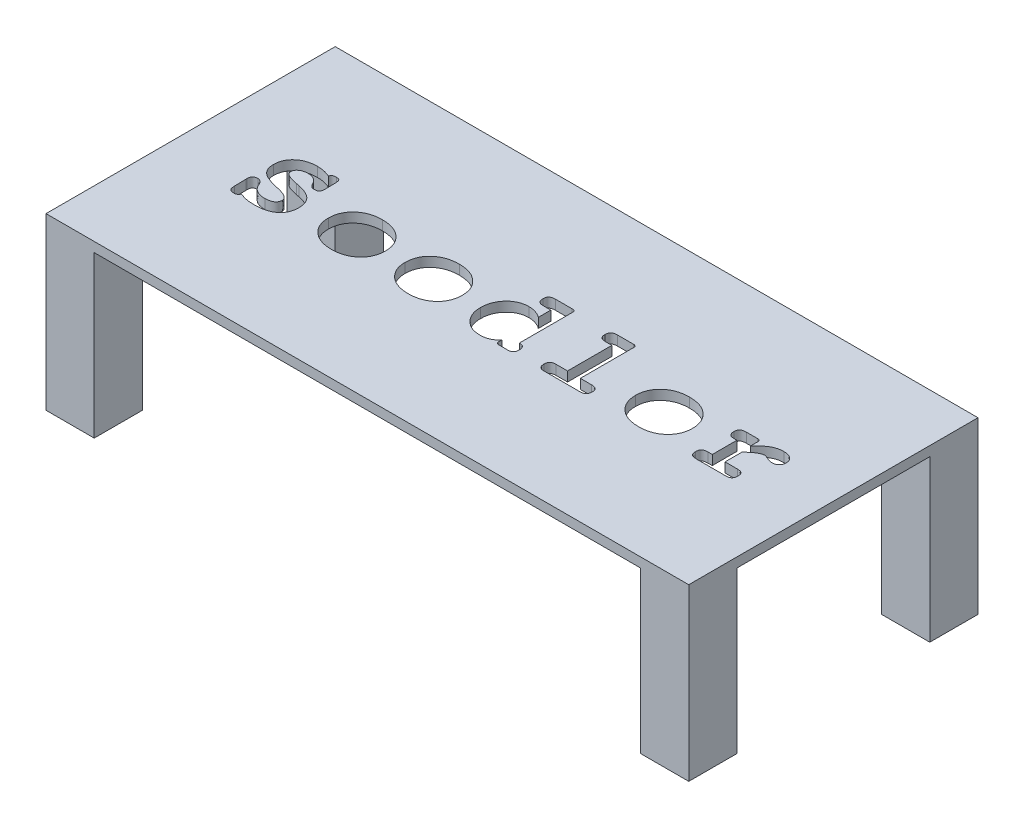
from build123d import *

# Parameters (mm, degrees)
SKETCH1_W           = 200
SKETCH1_H           = 90
BOSS_EXTRUDE1_DEPTH = 3
SKETCH2_W           = 15
SKETCH2_H           = 15
BOSS_EXTRUDE2_DEPTH = 50
CUT_EXTRUDE1_DEPTH  = 10


with BuildPart() as part:
    # Sketch1 → Boss-Extrude1 (new body)
    with BuildSketch(Plane(origin=(0, 0, 0), x_dir=(1, 0, 0), z_dir=(0, 1, 0))):
        Rectangle(SKETCH1_W, SKETCH1_H)
    extrude(amount=BOSS_EXTRUDE1_DEPTH)

    # Sketch2 → Boss-Extrude2 (add)
    with BuildSketch(Plane(origin=(0, 0, 0), x_dir=(-1, 0, 0), z_dir=(0, -1, 0))):
        with Locations((92.5, -37.5)):
            Rectangle(SKETCH2_W, SKETCH2_H)
        with Locations((92.5, 37.5)):
            Rectangle(SKETCH2_W, SKETCH2_H)
        with Locations((-92.5, -37.5)):
            Rectangle(SKETCH2_W, SKETCH2_H)
        with Locations((-92.5, 37.5)):
            Rectangle(SKETCH2_W, SKETCH2_H)
    extrude(amount=BOSS_EXTRUDE2_DEPTH)

    # Sketch3 → Cut-Extrude1 (cut)
    # profile 1 of 7: a face of its own
    with BuildSketch(Plane(origin=(0, 3, 0), x_dir=(1, 0, 0), z_dir=(0, 1, 0))):
        with BuildLine():
            add(Edge.make_bspline(
                [(-74.830880301, -9.316911034), (-74.872717316, -9.392583253), (-74.953316433, -9.538365981), (-75.089263433, -9.737289198), (-75.244768447, -9.894707863), (-75.406515023, -10.025670268), (-75.589241972, -10.124247081), (-75.800015205, -10.191115492), (-76.038968744, -10.226988972), (-76.207601854, -10.232824948), (-76.295464216, -10.235865647)],
                knots=[0, 0, 0, 0, 1.125130904, 2.167567619, 3.121740143, 3.993806461, 4.866860396, 5.805553904, 6.856634862, 8, 8, 8, 8], degree=3))
            add(Edge.make_bspline(
                [(-76.295464216, -10.235865647), (-76.448842947, -10.230072201), (-76.733878684, -10.219305786), (-77.127142465, -10.149877558), (-77.443028389, -10.014931546), (-77.694922661, -9.824478354), (-77.864971505, -9.549381594), (-77.987016234, -9.205694293), (-78.065302252, -8.779259205), (-78.08150604, -8.466911018), (-78.090297445, -8.29744576)],
                knots=[0, 0, 0, 0, 1.19497517, 2.220716172, 3.088578786, 3.84915171, 4.638209871, 5.565898967, 6.679372639, 8, 8, 8, 8], degree=3))
            Line((-78.090297445, -8.29744576), (-78.162090774, -4.549833978))
            Line((-78.162090774, -4.549833978), (-78.162090774, -4.372743766))
            add(Edge.make_bspline(
                [(-78.162090774, -4.372743766), (-78.158153423, -4.219337477), (-78.150882286, -3.936040917), (-78.08311521, -3.544551892), (-77.958779405, -3.227146808), (-77.787160273, -2.969120709), (-77.540532395, -2.784291518), (-77.226830072, -2.66275004), (-76.846197258, -2.587735738), (-76.568674894, -2.581339377), (-76.419905986, -2.577910538)],
                knots=[0, 0, 0, 0, 1.258531922, 2.324140461, 3.240671341, 4.039710179, 4.833152232, 5.725424941, 6.780689091, 8, 8, 8, 8], degree=3))
            add(Edge.make_bspline(
                [(-76.419905986, -2.577910538), (-76.336582814, -2.583140904), (-76.172400228, -2.59344698), (-75.931116962, -2.657247835), (-75.702417763, -2.770166028), (-75.488425899, -2.931972259), (-75.278594022, -3.130541354), (-75.084114689, -3.376355382), (-74.901832917, -3.666282067), (-74.795525882, -3.878753168), (-74.739942084, -3.989846011)],
                knots=[0, 0, 0, 0, 0.862109619, 1.698727773, 2.562257802, 3.48317382, 4.463674898, 5.543576174, 6.715631902, 8, 8, 8, 8], degree=3))
            add(Edge.make_bspline(
                [(-74.739942084, -3.989846011), (-74.688506393, -4.09496033), (-74.599112357, -4.27764657), (-74.513185847, -4.46198715), (-74.476699878, -4.540261534)],
                knots=[0, 0, 0, 0, 1.150763389, 2, 2, 2, 2], degree=3))
            add(Edge.make_bspline(
                [(-74.476699878, -4.540261534), (-74.363667126, -4.728707008), (-74.142817767, -5.096901727), (-73.731386053, -5.583813169), (-73.25464591, -5.982408046), (-72.726053704, -6.31635398), (-72.128083343, -6.56427928), (-71.464649877, -6.738517627), (-70.736124723, -6.851586805), (-70.2269803, -6.861322992), (-69.963292585, -6.866365399)],
                knots=[0, 0, 0, 0, 0.982757152, 1.920162832, 2.837434109, 3.755039021, 4.708845284, 5.722420853, 6.820433627, 8, 8, 8, 8], degree=3))
            add(Edge.make_bspline(
                [(-69.963292585, -6.866365399), (-69.729918819, -6.859319496), (-69.285835406, -6.845911953), (-68.661357262, -6.738555076), (-68.117171431, -6.556439983), (-67.656375081, -6.303985395), (-67.281844703, -5.981663936), (-67.015642358, -5.586793115), (-66.856374459, -5.130963817), (-66.837888477, -4.807992945), (-66.828317212, -4.640772195)],
                knots=[0, 0, 0, 0, 1.293732113, 2.461823289, 3.499898011, 4.462410317, 5.358847753, 6.212842595, 7.074684975, 8, 8, 8, 8], degree=3))
            add(Edge.make_bspline(
                [(-66.828317212, -4.640772195), (-66.83901695, -4.506249599), (-66.860731278, -4.233245908), (-67.057254058, -3.848167393), (-67.358032934, -3.492001514), (-67.785012056, -3.173268235), (-68.319042553, -2.873583781), (-68.970940596, -2.60442437), (-69.73757409, -2.362522057), (-70.291006898, -2.228199291), (-70.585501438, -2.156723007)],
                knots=[0, 0, 0, 0, 0.667298539, 1.354233194, 2.111195328, 2.978655329, 3.994226602, 5.160247515, 6.488901294, 8, 8, 8, 8], degree=3))
            add(Edge.make_bspline(
                [(-70.585501438, -2.156723007), (-70.759475117, -2.117153536), (-71.090049372, -2.041966022), (-71.555333592, -1.931056248), (-71.966668255, -1.837488407), (-72.219346808, -1.77123752), (-72.337258669, -1.740321698)],
                knots=[0, 0, 0, 0, 1.189004854, 2.259275063, 3.187694746, 4, 4, 4, 4], degree=3))
            add(Edge.make_bspline(
                [(-72.337258669, -1.740321698), (-72.58832812, -1.672170432), (-73.07411078, -1.540307702), (-73.767646309, -1.316175609), (-74.399691535, -1.07694486), (-74.972829706, -0.82869321), (-75.486091303, -0.567555881), (-75.937100982, -0.290029998), (-76.329608379, -0.002215695), (-76.665084706, 0.301154912), (-76.949066726, 0.630488933), (-77.191869995, 0.984121449), (-77.401453655, 1.36638809), (-77.566527017, 1.77845365), (-77.698205564, 2.218782896), (-77.785434531, 2.689038796), (-77.845930256, 3.187927137), (-77.852437434, 3.530711183), (-77.855772569, 3.706398874)],
                knots=[0, 0, 0, 0, 1.463732063, 2.832107426, 4.099267616, 5.265100837, 6.345135112, 7.336704633, 8.241627327, 9.080411787, 9.875950012, 10.682754482, 11.490207969, 12.323739583, 13.175869179, 14.072021647, 15.011849975, 16, 16, 16, 16], degree=3))
            add(Edge.make_bspline(
                [(-77.855772569, 3.706398874), (-77.849087943, 3.93166939), (-77.835941247, 4.374710305), (-77.739686197, 5.023631723), (-77.575897139, 5.639483163), (-77.350135746, 6.224988138), (-77.055962048, 6.77643061), (-76.700107899, 7.298416408), (-76.273474012, 7.782292829), (-75.792528246, 8.236026578), (-75.257609399, 8.645061532), (-74.681880348, 9.00634417), (-74.06581962, 9.308961847), (-73.410881339, 9.552618158), (-72.720418579, 9.743115554), (-71.992578991, 9.883346914), (-71.225494679, 9.964084359), (-70.700559144, 9.975369617), (-70.432342336, 9.981135841)],
                knots=[0, 0, 0, 0, 0.992234128, 1.951432983, 2.882273558, 3.794621431, 4.709564585, 5.62973003, 6.571255867, 7.545807784, 8.53829081, 9.53288696, 10.535595531, 11.556466521, 12.606887076, 13.687580771, 14.818465003, 16, 16, 16, 16], degree=3))
            add(Edge.make_bspline(
                [(-70.432342336, 9.981135841), (-70.072603891, 9.970590526), (-69.360099679, 9.949704292), (-68.300286343, 9.765755834), (-67.247169289, 9.480466339), (-66.56413923, 9.203486704), (-66.215680804, 9.062181228)],
                knots=[0, 0, 0, 0, 0.992740904, 1.96623988, 2.962445586, 4, 4, 4, 4], degree=3))
            add(Edge.make_bspline(
                [(-66.215680804, 9.062181228), (-66.176237569, 9.144669701), (-66.10201398, 9.299895068), (-65.967050184, 9.501633997), (-65.826882446, 9.66602347), (-65.666561876, 9.794304886), (-65.464570359, 9.883354775), (-65.215246999, 9.942081221), (-64.908147957, 9.971977201), (-64.685742122, 9.977903456), (-64.564434233, 9.981135841)],
                knots=[0, 0, 0, 0, 1.069344104, 2.012273056, 2.832922941, 3.591482327, 4.393857429, 5.395117902, 6.57920657, 8, 8, 8, 8], degree=3))
            add(Edge.make_bspline(
                [(-64.564434233, 9.981135841), (-64.442857652, 9.97690874), (-64.219822398, 9.969154017), (-63.915674238, 9.906018215), (-63.675057598, 9.792144475), (-63.494600471, 9.617918542), (-63.372787405, 9.372905895), (-63.295218514, 9.04989488), (-63.231900637, 8.643243138), (-63.220783327, 8.341376437), (-63.214719645, 8.176730169)],
                knots=[0, 0, 0, 0, 1.104668514, 2.026541791, 2.804895119, 3.492103925, 4.264216216, 5.256425918, 6.503580441, 8, 8, 8, 8], degree=3))
            Line((-63.214719645, 8.176730169), (-63.15249876, 5.05132724))
            Line((-63.15249876, 5.05132724), (-63.15249876, 4.874237028))
            add(Edge.make_bspline(
                [(-63.15249876, 4.874237028), (-63.155918646, 4.733350122), (-63.16223009, 4.473341482), (-63.236110909, 4.117051308), (-63.343576681, 3.820021519), (-63.520892583, 3.591589836), (-63.754595425, 3.426804049), (-64.047858123, 3.319327547), (-64.402022837, 3.254049593), (-64.659827934, 3.24631144), (-64.798959108, 3.242135345)],
                knots=[0, 0, 0, 0, 1.246463136, 2.300364134, 3.214218778, 4.020410916, 4.821002268, 5.716509432, 6.767655377, 8, 8, 8, 8], degree=3))
            add(Edge.make_bspline(
                [(-64.798959108, 3.242135345), (-64.891822071, 3.245735873), (-65.071145584, 3.25268869), (-65.32992305, 3.308771321), (-65.573905357, 3.391582441), (-65.792293291, 3.525871842), (-65.999291791, 3.683839344), (-66.1791224, 3.885395533), (-66.351369551, 4.114075812), (-66.438620329, 4.290226259), (-66.483709232, 4.381256168)],
                knots=[0, 0, 0, 0, 1.031275021, 1.991449058, 2.934094766, 3.880238862, 4.827712279, 5.819322876, 6.873083528, 8, 8, 8, 8], degree=3))
            add(Edge.make_bspline(
                [(-66.483709232, 4.381256168), (-66.511834906, 4.442174679), (-66.561799965, 4.550395979), (-66.617366712, 4.655842907), (-66.641654557, 4.701933038)],
                knots=[0, 0, 0, 0, 1.125813694, 2, 2, 2, 2], degree=3))
            add(Edge.make_bspline(
                [(-66.641654557, 4.701933038), (-66.728802961, 4.849636033), (-66.900123856, 5.139998315), (-67.219377775, 5.527292185), (-67.58779206, 5.855009474), (-67.996552691, 6.129214486), (-68.445344173, 6.347650701), (-68.934635456, 6.498168913), (-69.458213343, 6.598893007), (-69.820809044, 6.607322019), (-70.006368583, 6.611635593)],
                knots=[0, 0, 0, 0, 1.008657172, 1.982871076, 2.940827153, 3.902185302, 4.872678568, 5.867905458, 6.908893625, 8, 8, 8, 8], degree=3))
            add(Edge.make_bspline(
                [(-70.006368583, 6.611635593), (-70.238387072, 6.605922329), (-70.683786444, 6.594954736), (-71.315377573, 6.466701059), (-71.881007911, 6.269104915), (-72.364862277, 5.98597075), (-72.764357923, 5.645234594), (-73.051539043, 5.240996571), (-73.228923602, 4.787553428), (-73.250191439, 4.467383315), (-73.260999504, 4.304676617)],
                knots=[0, 0, 0, 0, 1.250794327, 2.401114711, 3.463703516, 4.471174861, 5.411065496, 6.276153812, 7.123961572, 8, 8, 8, 8], degree=3))
            add(Edge.make_bspline(
                [(-73.260999504, 4.304676617), (-73.247001936, 4.184046458), (-73.218180992, 3.935669365), (-73.001497005, 3.589134574), (-72.661789336, 3.277187964), (-72.193304482, 2.991053938), (-71.603954972, 2.719143482), (-70.883892692, 2.475257886), (-70.036270892, 2.247047111), (-69.423265396, 2.121810748), (-69.096986413, 2.055152303)],
                knots=[0, 0, 0, 0, 0.575216185, 1.184368198, 1.902840588, 2.771560498, 3.800045154, 5.005375968, 6.4060781, 8, 8, 8, 8], degree=3))
            add(Edge.make_bspline(
                [(-69.096986413, 2.055152303), (-68.988378551, 2.035028687), (-68.785318602, 1.997404334), (-68.504314652, 1.936007551), (-68.265246609, 1.896815864), (-68.122118412, 1.867283309), (-68.058376252, 1.854130982)],
                knots=[0, 0, 0, 0, 1.252859378, 2.34242306, 3.261797903, 4, 4, 4, 4], degree=3))
            add(Edge.make_bspline(
                [(-68.058376252, 1.854130982), (-67.815425747, 1.798578429), (-67.34302303, 1.690559813), (-66.66208967, 1.502057254), (-66.033196699, 1.280301824), (-65.453691991, 1.037743632), (-64.923100164, 0.771564229), (-64.449312354, 0.471730455), (-64.017820469, 0.156697654), (-63.637103624, -0.189551998), (-63.305055736, -0.566248539), (-63.014849088, -0.96874633), (-62.775536046, -1.406025479), (-62.571412481, -1.870574234), (-62.420570614, -2.372534954), (-62.309591646, -2.904002434), (-62.249231862, -3.466768247), (-62.238850714, -3.850915056), (-62.233544147, -4.047280674)],
                knots=[0, 0, 0, 0, 1.307952211, 2.543234804, 3.705798313, 4.805287046, 5.838839316, 6.816940384, 7.744716293, 8.639720481, 9.511710956, 10.376069779, 11.238154396, 12.123233041, 13.034347239, 13.983527126, 14.969232766, 16, 16, 16, 16], degree=3))
            add(Edge.make_bspline(
                [(-62.233544147, -4.047280674), (-62.240537732, -4.288444092), (-62.254159559, -4.758172605), (-62.343741397, -5.442237781), (-62.50236158, -6.082381744), (-62.722655472, -6.680317346), (-63.006660264, -7.235062842), (-63.355105605, -7.748148436), (-63.767219917, -8.217043598), (-64.241515615, -8.639900716), (-64.768718142, -9.020944591), (-65.357517764, -9.344159397), (-65.99723063, -9.624821436), (-66.694499345, -9.845984809), (-67.442867378, -10.024579787), (-68.245115978, -10.144915417), (-69.100150645, -10.224755138), (-69.688686725, -10.232086939), (-69.992009917, -10.235865647)],
                knots=[0, 0, 0, 0, 1.027461098, 2.001247864, 2.932670853, 3.831634272, 4.710168172, 5.581149534, 6.467380143, 7.362635631, 8.283156822, 9.232511859, 10.218744292, 11.254802792, 12.34456336, 13.493350062, 14.708107987, 16, 16, 16, 16], degree=3))
            add(Edge.make_bspline(
                [(-69.992009917, -10.235865647), (-70.22822348, -10.233487525), (-70.686705156, -10.228871681), (-71.355460586, -10.182333225), (-71.987464663, -10.120544816), (-72.778401237, -9.983106105), (-73.736115622, -9.747871482), (-74.465133939, -9.460889205), (-74.830880301, -9.316911034)],
                knots=[0, 0, 0, 0, 0.856949438, 1.663306752, 2.431741917, 3.159800518, 4.575080206, 6, 6, 6, 6], degree=3))
        make_face()
    # profile 2 of 7: a face of its own
    with BuildSketch(Plane(origin=(0, 3, 0), x_dir=(1, 0, 0), z_dir=(0, 1, 0))):
        with BuildLine():
            add(Edge.make_bspline(
                [(-37.115451389, -2.262019889), (-37.122500846, -2.547998522), (-37.136343923, -3.109577161), (-37.254419964, -3.932184252), (-37.444420919, -4.715303573), (-37.713289747, -5.459770022), (-38.065701981, -6.159152432), (-38.48911353, -6.822815738), (-38.996650487, -7.439322887), (-39.567461109, -8.017993591), (-40.203920101, -8.537601712), (-40.890376311, -8.995275217), (-41.626965048, -9.379935384), (-42.410863722, -9.689794802), (-43.238939658, -9.934968247), (-44.113154808, -10.111386019), (-45.035550318, -10.218745155), (-45.666538792, -10.230074145), (-45.989106872, -10.235865647)],
                knots=[0, 0, 0, 0, 1.024375917, 2.011575572, 2.971105969, 3.907937159, 4.841150384, 5.772049158, 6.722974034, 7.697242858, 8.680345096, 9.661850199, 10.648917411, 11.652160265, 12.67781167, 13.739601366, 14.844459958, 16, 16, 16, 16], degree=3))
            add(Edge.make_bspline(
                [(-45.989106872, -10.235865647), (-46.310072875, -10.230010108), (-46.939452426, -10.218528032), (-47.860317258, -10.11150179), (-48.734329521, -9.934559851), (-49.563699927, -9.691082144), (-50.345513225, -9.374191268), (-51.083735149, -8.989319601), (-51.775973039, -8.533469058), (-52.41354354, -8.00794123), (-52.991476848, -7.43165219), (-53.499321653, -6.810952815), (-53.926313583, -6.147091081), (-54.278498579, -5.446615108), (-54.546818066, -4.705132547), (-54.745081209, -3.926712347), (-54.860262437, -3.106250285), (-54.874617248, -2.546357601), (-54.881907242, -2.262019889)],
                knots=[0, 0, 0, 0, 1.149401149, 2.253851097, 3.315248078, 4.340520134, 5.34552281, 6.332224944, 7.318132338, 8.308913989, 9.286855165, 10.237428331, 11.175881437, 12.108749503, 13.039865373, 13.99487765, 14.981712178, 16, 16, 16, 16], degree=3))
            add(Edge.make_bspline(
                [(-54.881907242, -2.262019889), (-54.874553289, -1.977701467), (-54.860072535, -1.417846767), (-54.746017544, -0.598645356), (-54.544715303, 0.178785167), (-54.281082854, 0.92052882), (-53.924465964, 1.618871107), (-53.501154456, 2.281980082), (-52.989456923, 2.897910219), (-52.415383798, 3.474885511), (-51.774215275, 3.994521489), (-51.08400964, 4.451319069), (-50.34532563, 4.835301044), (-49.564601289, 5.154121748), (-48.733394419, 5.389793897), (-47.860456923, 5.568789286), (-46.939415246, 5.675217671), (-46.310060318, 5.68678299), (-45.989106872, 5.69268098)],
                knots=[0, 0, 0, 0, 1.019238905, 2.00699514, 2.957354995, 3.894714367, 4.823340878, 5.762670502, 6.709701953, 7.688556529, 8.67664398, 9.663472215, 10.651095932, 11.657037283, 12.681655471, 13.7440438, 14.849525307, 16, 16, 16, 16], degree=3))
            add(Edge.make_bspline(
                [(-45.989106872, 5.69268098), (-45.666555728, 5.68683591), (-45.035600383, 5.675402132), (-44.112967826, 5.568792786), (-43.240042384, 5.389779696), (-42.408793291, 5.154172811), (-41.628221534, 4.835115405), (-40.890163331, 4.452611263), (-40.204053734, 3.994218909), (-39.567140063, 3.475080232), (-38.998645191, 2.896150382), (-38.485753075, 2.283633276), (-38.068848266, 1.617313894), (-37.711581025, 0.920641438), (-37.446454616, 0.179501659), (-37.252959607, -0.599442589), (-37.136845238, -1.417738505), (-37.12265686, -1.977665004), (-37.115451389, -2.262019889)],
                knots=[0, 0, 0, 0, 1.1570596, 2.263371103, 3.326557073, 4.351944545, 5.358641157, 6.347006382, 7.329802183, 8.31419722, 9.289747226, 10.237489709, 11.174434278, 12.103758001, 13.041821143, 13.991498008, 14.97999585, 16, 16, 16, 16], degree=3))
        make_face()
        with BuildLine():
            add(Edge.make_bspline(
                [(-45.989106872, -6.866365399), (-45.835731552, -6.863217249), (-45.535620481, -6.85705723), (-45.095931038, -6.793089184), (-44.677987478, -6.68690236), (-44.279685631, -6.544028632), (-43.902114426, -6.360320398), (-43.546191356, -6.135248951), (-43.215643551, -5.863388141), (-42.904949483, -5.558728094), (-42.623785036, -5.220682294), (-42.379762643, -4.855901453), (-42.172269134, -4.471426408), (-42.005099112, -4.065014748), (-41.867642803, -3.638708516), (-41.781614194, -3.186789143), (-41.720032958, -2.715205672), (-41.713540557, -2.393058441), (-41.710224454, -2.228516336)],
                knots=[0, 0, 0, 0, 1.040714595, 2.036376984, 3.008368775, 3.964295491, 4.904069766, 5.853593191, 6.816124392, 7.804157524, 8.804052791, 9.79540506, 10.779154276, 11.764809753, 12.775383787, 13.814123751, 14.883527021, 16, 16, 16, 16], degree=3))
            add(Edge.make_bspline(
                [(-41.710224454, -2.228516336), (-41.714384495, -2.065689522), (-41.722563448, -1.745559758), (-41.772592454, -1.275321086), (-41.871228934, -0.829550347), (-41.99818064, -0.405142095), (-42.16803355, -0.007273009), (-42.369162964, 0.371878335), (-42.614970932, 0.723931955), (-42.890520187, 1.053956115), (-43.196910499, 1.350743388), (-43.528664333, 1.611257971), (-43.884255135, 1.830821155), (-44.260799676, 2.017025648), (-44.661987143, 2.153779207), (-45.085944533, 2.248318213), (-45.529172634, 2.314195886), (-45.834103992, 2.32015274), (-45.989106872, 2.323180732)],
                knots=[0, 0, 0, 0, 1.113869523, 2.189951276, 3.227959408, 4.232387996, 5.215307525, 6.18198135, 7.162657251, 8.146242817, 9.118566162, 10.074650562, 11.025427331, 11.972188129, 12.941875035, 13.915972415, 14.940645925, 16, 16, 16, 16], degree=3))
            add(Edge.make_bspline(
                [(-45.989106872, 2.323180732), (-46.14250774, 2.320148778), (-46.442668803, 2.314216123), (-46.881619096, 2.248668934), (-47.299995624, 2.148727211), (-47.700509267, 2.010220737), (-48.078897969, 1.827699229), (-48.435451724, 1.604715621), (-48.773464056, 1.346489279), (-49.081141967, 1.044370614), (-49.363362265, 0.714754545), (-49.613699898, 0.362440344), (-49.819407673, -0.016737752), (-49.995360178, -0.413631379), (-50.12070963, -0.837772219), (-50.218602998, -1.280373437), (-50.276614036, -1.74676581), (-50.283577063, -2.065624868), (-50.287134177, -2.228516336)],
                knots=[0, 0, 0, 0, 1.048705272, 2.052012423, 3.028848771, 3.988459953, 4.945273883, 5.89628075, 6.861215237, 7.849207476, 8.840089291, 9.827237144, 10.799366998, 11.7868165, 12.791488171, 13.81907949, 14.885860908, 16, 16, 16, 16], degree=3))
            add(Edge.make_bspline(
                [(-50.287134177, -2.228516336), (-50.283666212, -2.393027853), (-50.276876491, -2.715115199), (-50.217392269, -3.187451255), (-50.123503548, -3.638119699), (-49.987512697, -4.064890388), (-49.821285894, -4.472878653), (-49.606881403, -4.854345209), (-49.364617799, -5.222407382), (-49.077556102, -5.558571984), (-48.762721213, -5.863813141), (-48.427633415, -6.133660353), (-48.070604407, -6.362060732), (-47.691083238, -6.541589951), (-47.294316916, -6.688107844), (-46.877404269, -6.792857832), (-46.439414145, -6.85688802), (-46.1408909, -6.863170881), (-45.989106872, -6.866365399)],
                knots=[0, 0, 0, 0, 1.115130618, 2.183248119, 3.222936602, 4.2322956, 5.216766001, 6.204500275, 7.194660619, 8.200302319, 9.194885281, 10.164683171, 11.113064962, 12.061446753, 13.006057135, 13.976880278, 14.971345559, 16, 16, 16, 16], degree=3))
        make_face(mode=Mode.SUBTRACT)
    # profile 3 of 7: a face of its own
    with BuildSketch(Plane(origin=(0, 3, 0), x_dir=(1, 0, 0), z_dir=(0, 1, 0))):
        with BuildLine():
            add(Edge.make_bspline(
                [(-13.222631448, -2.262019889), (-13.229680905, -2.547998522), (-13.243523982, -3.109577161), (-13.361600024, -3.932184252), (-13.551600979, -4.715303573), (-13.820469807, -5.459770022), (-14.17288204, -6.159152432), (-14.596293589, -6.822815738), (-15.103830546, -7.439322887), (-15.674641169, -8.017993591), (-16.31110016, -8.537601712), (-16.99755637, -8.995275217), (-17.734145108, -9.379935384), (-18.518043781, -9.689794802), (-19.346119717, -9.934968247), (-20.220334868, -10.111386019), (-21.142730377, -10.218745155), (-21.773718851, -10.230074145), (-22.096286931, -10.235865647)],
                knots=[0, 0, 0, 0, 1.024375917, 2.011575572, 2.971105969, 3.907937159, 4.841150384, 5.772049158, 6.722974034, 7.697242858, 8.680345096, 9.661850199, 10.648917411, 11.652160265, 12.67781167, 13.739601366, 14.844459958, 16, 16, 16, 16], degree=3))
            add(Edge.make_bspline(
                [(-22.096286931, -10.235865647), (-22.417252935, -10.230010108), (-23.046632486, -10.218528032), (-23.967497318, -10.11150179), (-24.84150958, -9.934559851), (-25.670879987, -9.691082144), (-26.452693284, -9.374191268), (-27.190915209, -8.989319601), (-27.883153098, -8.533469058), (-28.5207236, -8.00794123), (-29.098656908, -7.43165219), (-29.606501712, -6.810952815), (-30.033493642, -6.147091081), (-30.385678638, -5.446615108), (-30.653998125, -4.705132547), (-30.852261268, -3.926712347), (-30.967442497, -3.106250285), (-30.981797308, -2.546357601), (-30.989087302, -2.262019889)],
                knots=[0, 0, 0, 0, 1.149401149, 2.253851097, 3.315248078, 4.340520134, 5.34552281, 6.332224944, 7.318132338, 8.308913989, 9.286855165, 10.237428331, 11.175881437, 12.108749503, 13.039865373, 13.99487765, 14.981712178, 16, 16, 16, 16], degree=3))
            add(Edge.make_bspline(
                [(-30.989087302, -2.262019889), (-30.981733349, -1.977701467), (-30.967252595, -1.417846767), (-30.853197604, -0.598645356), (-30.651895362, 0.178785167), (-30.388262914, 0.92052882), (-30.031646023, 1.618871107), (-29.608334516, 2.281980082), (-29.096636982, 2.897910219), (-28.522563858, 3.474885511), (-27.881395335, 3.994521489), (-27.1911897, 4.451319069), (-26.452505689, 4.835301044), (-25.671781349, 5.154121748), (-24.840574479, 5.389793897), (-23.967636983, 5.568789286), (-23.046595305, 5.675217671), (-22.417240377, 5.68678299), (-22.096286931, 5.69268098)],
                knots=[0, 0, 0, 0, 1.019238905, 2.00699514, 2.957354995, 3.894714367, 4.823340878, 5.762670502, 6.709701953, 7.688556529, 8.67664398, 9.663472215, 10.651095932, 11.657037283, 12.681655471, 13.7440438, 14.849525307, 16, 16, 16, 16], degree=3))
            add(Edge.make_bspline(
                [(-22.096286931, 5.69268098), (-21.773735787, 5.68683591), (-21.142780442, 5.675402132), (-20.220147885, 5.568792786), (-19.347222444, 5.389779696), (-18.51597335, 5.154172811), (-17.735401593, 4.835115405), (-16.99734339, 4.452611263), (-16.311233793, 3.994218909), (-15.674320123, 3.475080232), (-15.10582525, 2.896150382), (-14.592933135, 2.283633276), (-14.176028325, 1.617313894), (-13.818761085, 0.920641438), (-13.553634675, 0.179501659), (-13.360139666, -0.599442589), (-13.244025298, -1.417738505), (-13.22983692, -1.977665004), (-13.222631448, -2.262019889)],
                knots=[0, 0, 0, 0, 1.1570596, 2.263371103, 3.326557073, 4.351944545, 5.358641157, 6.347006382, 7.329802183, 8.31419722, 9.289747226, 10.237489709, 11.174434278, 12.103758001, 13.041821143, 13.991498008, 14.97999585, 16, 16, 16, 16], degree=3))
        make_face()
        with BuildLine():
            add(Edge.make_bspline(
                [(-22.096286931, -6.866365399), (-21.942911611, -6.863217249), (-21.64280054, -6.85705723), (-21.203111098, -6.793089184), (-20.785167537, -6.68690236), (-20.38686569, -6.544028632), (-20.009294486, -6.360320398), (-19.653371415, -6.135248951), (-19.322823611, -5.863388141), (-19.012129542, -5.558728094), (-18.730965096, -5.220682294), (-18.486942703, -4.855901453), (-18.279449194, -4.471426408), (-18.112279171, -4.065014748), (-17.974822862, -3.638708516), (-17.888794254, -3.186789143), (-17.827213017, -2.715205672), (-17.820720617, -2.393058441), (-17.817404514, -2.228516336)],
                knots=[0, 0, 0, 0, 1.040714595, 2.036376984, 3.008368775, 3.964295491, 4.904069766, 5.853593191, 6.816124392, 7.804157524, 8.804052791, 9.79540506, 10.779154276, 11.764809753, 12.775383787, 13.814123751, 14.883527021, 16, 16, 16, 16], degree=3))
            add(Edge.make_bspline(
                [(-17.817404514, -2.228516336), (-17.821564555, -2.065689522), (-17.829743508, -1.745559758), (-17.879772513, -1.275321086), (-17.978408993, -0.829550347), (-18.1053607, -0.405142095), (-18.275213609, -0.007273009), (-18.476343023, 0.371878335), (-18.722150992, 0.723931955), (-18.997700247, 1.053956115), (-19.304090559, 1.350743388), (-19.635844393, 1.611257971), (-19.991435195, 1.830821155), (-20.367979736, 2.017025648), (-20.769167202, 2.153779207), (-21.193124593, 2.248318213), (-21.636352694, 2.314195886), (-21.941284052, 2.32015274), (-22.096286931, 2.323180732)],
                knots=[0, 0, 0, 0, 1.113869523, 2.189951276, 3.227959408, 4.232387996, 5.215307525, 6.18198135, 7.162657251, 8.146242817, 9.118566162, 10.074650562, 11.025427331, 11.972188129, 12.941875035, 13.915972415, 14.940645925, 16, 16, 16, 16], degree=3))
            add(Edge.make_bspline(
                [(-22.096286931, 2.323180732), (-22.2496878, 2.320148778), (-22.549848862, 2.314216123), (-22.988799155, 2.248668934), (-23.407175683, 2.148727211), (-23.807689327, 2.010220737), (-24.186078028, 1.827699229), (-24.542631783, 1.604715621), (-24.880644116, 1.346489279), (-25.188322027, 1.044370614), (-25.470542325, 0.714754545), (-25.720879958, 0.362440344), (-25.926587732, -0.016737752), (-26.102540237, -0.413631379), (-26.227889689, -0.837772219), (-26.325783057, -1.280373437), (-26.383794095, -1.74676581), (-26.390757123, -2.065624868), (-26.394314236, -2.228516336)],
                knots=[0, 0, 0, 0, 1.048705272, 2.052012423, 3.028848771, 3.988459953, 4.945273883, 5.89628075, 6.861215237, 7.849207476, 8.840089291, 9.827237144, 10.799366998, 11.7868165, 12.791488171, 13.81907949, 14.885860908, 16, 16, 16, 16], degree=3))
            add(Edge.make_bspline(
                [(-26.394314236, -2.228516336), (-26.390846272, -2.393027853), (-26.38405655, -2.715115199), (-26.324572328, -3.187451255), (-26.230683607, -3.638119699), (-26.094692756, -4.064890388), (-25.928465953, -4.472878653), (-25.714061462, -4.854345209), (-25.471797858, -5.222407382), (-25.184736162, -5.558571984), (-24.869901273, -5.863813141), (-24.534813474, -6.133660353), (-24.177784467, -6.362060732), (-23.798263298, -6.541589951), (-23.401496976, -6.688107844), (-22.984584329, -6.792857832), (-22.546594204, -6.85688802), (-22.24807096, -6.863170881), (-22.096286931, -6.866365399)],
                knots=[0, 0, 0, 0, 1.115130618, 2.183248119, 3.222936602, 4.2322956, 5.216766001, 6.204500275, 7.194660619, 8.200302319, 9.194885281, 10.164683171, 11.113064962, 12.061446753, 13.006057135, 13.976880278, 14.971345559, 16, 16, 16, 16], degree=3))
        make_face(mode=Mode.SUBTRACT)
    # profile 4 of 7: a face of its own
    with BuildSketch(Plane(origin=(0, 3, 0), x_dir=(1, 0, 0), z_dir=(0, 1, 0))):
        with BuildLine():
            add(Edge.make_bspline(
                [(2.351734755, 7.530590206), (2.175854517, 7.535539892), (1.849035986, 7.544737337), (1.398479972, 7.624405489), (1.023862498, 7.753774059), (0.725448954, 7.950922511), (0.507161268, 8.217739831), (0.35869995, 8.545911411), (0.267363004, 8.936034849), (0.259544143, 9.217970196), (0.255369544, 9.368499433)],
                knots=[0, 0, 0, 0, 1.305259189, 2.425416843, 3.385062485, 4.229628444, 5.045791785, 5.909749139, 6.883985745, 8, 8, 8, 8], degree=3))
            add(Edge.make_bspline(
                [(0.255369544, 9.368499433), (0.259593883, 9.520606344), (0.267510432, 9.805659685), (0.3580432, 10.199168555), (0.505975293, 10.528073658), (0.725753577, 10.791783388), (1.026385334, 10.981074457), (1.396522513, 11.120758335), (1.84993474, 11.189683399), (2.176071508, 11.20055371), (2.351734755, 11.206408659)],
                knots=[0, 0, 0, 0, 1.126462529, 2.111027731, 2.973930803, 3.780028489, 4.616980445, 5.579610134, 6.696333611, 8, 8, 8, 8], degree=3))
            Line((2.351734755, 11.206408659), (7.535213119, 11.206408659))
            add(Edge.make_bspline(
                [(7.535213119, 11.206408659), (7.623079489, 11.204030968), (7.784151422, 11.199672313), (8.006399628, 11.159858553), (8.181806368, 11.082210814), (8.323869302, 10.978769421), (8.418157847, 10.824474188), (8.482840176, 10.630345245), (8.518014783, 10.387568884), (8.52316591, 10.210975015), (8.525961062, 10.115150056)],
                knots=[0, 0, 0, 0, 1.216155503, 2.229391252, 3.099206826, 3.854428163, 4.619907646, 5.55560303, 6.67359924, 8, 8, 8, 8], degree=3))
            Line((8.525961062, 10.115150056), (8.525961062, -6.25372899))
            Line((8.525961062, -6.25372899), (8.774844603, -6.25372899))
            add(Edge.make_bspline(
                [(8.774844603, -6.25372899), (8.89978485, -6.258572666), (9.135523777, -6.267711778), (9.467224382, -6.353572945), (9.745543693, -6.505997598), (9.979492262, -6.710867184), (10.151212342, -6.977988278), (10.278029062, -7.29419369), (10.352934809, -7.663820897), (10.360102647, -7.928554697), (10.363870288, -8.067707106)],
                knots=[0, 0, 0, 0, 1.087873961, 2.052615108, 2.954900484, 3.831421137, 4.733920807, 5.694544045, 6.788179857, 8, 8, 8, 8], degree=3))
            add(Edge.make_bspline(
                [(10.363870288, -8.067707106), (10.360987823, -8.221367136), (10.355594302, -8.508887943), (10.273033792, -8.904500055), (10.147664867, -9.23819859), (9.954201707, -9.502920571), (9.696704789, -9.704636108), (9.367173663, -9.836011552), (8.970057277, -9.915191204), (8.68114777, -9.924530742), (8.525961062, -9.929547442)],
                knots=[0, 0, 0, 0, 1.210420588, 2.264877253, 3.17443202, 4.002985919, 4.819104297, 5.721835338, 6.776292003, 8, 8, 8, 8], degree=3))
            Line((8.525961062, -9.929547442), (5.955759878, -9.929547442))
            add(Edge.make_bspline(
                [(5.955759878, -9.929547442), (5.878897268, -9.929036448), (5.733630055, -9.92807069), (5.53046307, -9.885672527), (5.351547028, -9.83356543), (5.205528152, -9.74889069), (5.085104327, -9.650602159), (5.00892906, -9.522406872), (4.950759352, -9.384041132), (4.947517054, -9.282455814), (4.945867048, -9.230759039)],
                knots=[0, 0, 0, 0, 1.33031237, 2.514236365, 3.591334294, 4.546165611, 5.429237791, 6.251146688, 7.110008441, 8, 8, 8, 8], degree=3))
            Line((4.945867048, -9.230759039), (4.945867048, -8.086851994))
            add(Edge.make_bspline(
                [(4.945867048, -8.086851994), (4.806580376, -8.256787293), (4.53104443, -8.592952143), (4.044132836, -9.024659298), (3.513830514, -9.398068854), (2.932610734, -9.703331558), (2.308199666, -9.944848612), (1.640365644, -10.108683579), (0.935507846, -10.219426522), (0.450453847, -10.230308082), (0.202721102, -10.235865647)],
                knots=[0, 0, 0, 0, 0.974845189, 1.928432114, 2.880146906, 3.850368706, 4.83760671, 5.846713577, 6.900247069, 8, 8, 8, 8], degree=3))
            add(Edge.make_bspline(
                [(0.202721102, -10.235865647), (-0.051291032, -10.229631412), (-0.551782812, -10.217347812), (-1.285998175, -10.114211936), (-1.98874872, -9.947870998), (-2.65871341, -9.710694761), (-3.299404176, -9.409898519), (-3.902904686, -9.032686071), (-4.476569738, -8.593590653), (-5.014187948, -8.095578695), (-5.498903681, -7.541844501), (-5.926840072, -6.95314795), (-6.289442021, -6.329428435), (-6.587102721, -5.672311236), (-6.817592602, -4.979262078), (-6.979227495, -4.254420076), (-7.076927376, -3.49634284), (-7.089729922, -2.980247684), (-7.096267361, -2.716710974)],
                knots=[0, 0, 0, 0, 1.040905028, 2.050943005, 3.032872038, 3.99679742, 4.959301737, 5.928493422, 6.908263767, 7.917115258, 8.927364961, 9.92031861, 10.896239499, 11.87973551, 12.872473745, 13.88477489, 14.919890143, 16, 16, 16, 16], degree=3))
            add(Edge.make_bspline(
                [(-7.096267361, -2.716710974), (-7.089478129, -2.446845639), (-7.076137085, -1.916552178), (-6.981446569, -1.136869822), (-6.810634073, -0.391482714), (-6.583066766, 0.322534139), (-6.287854872, 1.003723403), (-5.929836627, 1.651664422), (-5.497960051, 2.263073154), (-5.01010991, 2.837501567), (-4.471755272, 3.35954322), (-3.903185635, 3.825598806), (-3.29193861, 4.208076795), (-2.658363205, 4.532159744), (-1.988920302, 4.776728596), (-1.291836554, 4.954762364), (-0.561650754, 5.062427733), (-0.064074007, 5.074115166), (0.188362436, 5.080044571)],
                knots=[0, 0, 0, 0, 1.088124188, 2.138196598, 3.160430374, 4.167470763, 5.155782467, 6.149272986, 7.146920388, 8.169154164, 9.183646328, 10.167235918, 11.127383826, 12.085417391, 13.031868818, 13.994556406, 14.982574948, 16, 16, 16, 16], degree=3))
            add(Edge.make_bspline(
                [(0.188362436, 5.080044571), (0.391218565, 5.075610673), (0.795012995, 5.066784796), (1.39145919, 4.991003352), (1.975721428, 4.879892894), (2.538521255, 4.708204902), (3.083425819, 4.504807531), (3.60249155, 4.26173935), (4.089655188, 3.972143984), (4.392363482, 3.750361326), (4.543824405, 3.639391767)],
                knots=[0, 0, 0, 0, 1.041970406, 2.074089894, 3.085389564, 4.094427113, 5.093289009, 6.072443529, 7.035541844, 8, 8, 8, 8], degree=3))
            Line((4.543824405, 3.639391767), (4.543824405, 7.530590206))
            Line((4.543824405, 7.530590206), (2.351734755, 7.530590206))
        make_face()
        with BuildLine():
            add(Edge.make_bspline(
                [(0.978089057, -6.866365399), (1.102733843, -6.86273255), (1.348594495, -6.85556679), (1.708670467, -6.797523729), (2.050806902, -6.699209812), (2.380003566, -6.572945725), (2.685497494, -6.396763886), (2.978280909, -6.189546056), (3.248314214, -5.939211455), (3.503602231, -5.657163849), (3.729594564, -5.342281361), (3.932783166, -5.007551803), (4.100450501, -4.649078072), (4.239925029, -4.27165071), (4.344621438, -3.870512919), (4.419830643, -3.449621217), (4.470297402, -3.008292095), (4.474617237, -2.707281774), (4.476817298, -2.553979428)],
                knots=[0, 0, 0, 0, 0.962853468, 1.899219285, 2.808576767, 3.710550527, 4.615804049, 5.525829808, 6.477010931, 7.454744675, 8.460824398, 9.467206202, 10.476377965, 11.51384246, 12.572407138, 13.675063722, 14.815927025, 16, 16, 16, 16], degree=3))
            add(Edge.make_bspline(
                [(4.476817298, -2.553979428), (4.474706083, -2.402257583), (4.470583465, -2.105986768), (4.419495071, -1.672742358), (4.34555438, -1.259003352), (4.233912664, -0.865705792), (4.094925338, -0.491101071), (3.928846948, -0.135066316), (3.725494279, 0.197974046), (3.491741102, 0.504653111), (3.241155707, 0.789244363), (2.965048288, 1.032203915), (2.679442789, 1.24824263), (2.368509837, 1.412793123), (2.04717041, 1.552531069), (1.704187488, 1.638783132), (1.347270245, 1.700739943), (1.102818764, 1.707231864), (0.978089057, 1.710544323)],
                knots=[0, 0, 0, 0, 1.180875165, 2.305922699, 3.392727196, 4.450817621, 5.484706431, 6.50173641, 7.505321508, 8.51664399, 9.501991149, 10.452249902, 11.376654265, 12.282930466, 13.185109711, 14.098257844, 15.029648987, 16, 16, 16, 16], degree=3))
            add(Edge.make_bspline(
                [(0.978089057, 1.710544323), (0.854955859, 1.707220926), (0.613678583, 1.700708787), (0.261458174, 1.638931555), (-0.077962896, 1.551603786), (-0.398000632, 1.412880184), (-0.708882863, 1.248206542), (-0.994578131, 1.032261136), (-1.270365096, 0.789043966), (-1.521563957, 0.506148227), (-1.750054414, 0.196556947), (-1.952364122, -0.136260169), (-2.126796524, -0.488771712), (-2.256792919, -0.866981299), (-2.370774022, -1.258794834), (-2.444020217, -1.67280071), (-2.495301206, -2.105971112), (-2.49939688, -2.40225228), (-2.501494296, -2.553979428)],
                knots=[0, 0, 0, 0, 0.960523975, 1.882129361, 2.785708989, 3.690318534, 4.599036071, 5.525930605, 6.478749176, 7.466750673, 8.473347633, 9.479636199, 10.50479408, 11.537192719, 12.59813344, 13.687865582, 14.815943781, 16, 16, 16, 16], degree=3))
            add(Edge.make_bspline(
                [(-2.501494296, -2.553979428), (-2.499294235, -2.707281774), (-2.494974399, -3.008292094), (-2.444507645, -3.449621222), (-2.369298424, -3.870512899), (-2.26460207, -4.27165078), (-2.125127343, -4.649077817), (-1.957460729, -5.007552726), (-1.754269458, -5.342277926), (-1.528286987, -5.657176513), (-1.272963487, -5.939166198), (-1.003056516, -6.189707025), (-0.710961335, -6.395392257), (-0.409687433, -6.572945296), (-0.08377799, -6.700111372), (0.255632912, -6.796767645), (0.612307638, -6.855703461), (0.855024885, -6.862778277), (0.978089057, -6.866365399)],
                knots=[0, 0, 0, 0, 1.187535651, 2.331735268, 3.437616436, 4.499276756, 5.539775188, 6.551898151, 7.561222994, 8.570244873, 9.55083788, 10.504800616, 11.417487633, 12.314632665, 13.20776437, 14.119781156, 15.046678476, 16, 16, 16, 16], degree=3))
        make_face(mode=Mode.SUBTRACT)
    # profile 5 of 7: a face of its own
    with BuildSketch(Plane(origin=(0, 3, 0), x_dir=(1, 0, 0), z_dir=(0, 1, 0))):
        with BuildLine():
            Line((23.535553075, 7.530590206), (21.678498961, 7.530590206))
            add(Edge.make_bspline(
                [(21.678498961, 7.530590206), (21.501002013, 7.535399291), (21.172547618, 7.544298402), (20.719110222, 7.625165604), (20.34134588, 7.753769699), (20.038279168, 7.950679162), (19.814899624, 8.217215479), (19.661665607, 8.545394032), (19.564027366, 8.935382938), (19.557106573, 9.217875097), (19.553416419, 9.368499433)],
                knots=[0, 0, 0, 0, 1.309182976, 2.422615751, 3.387559839, 4.236829281, 5.055665697, 5.919508986, 6.890685748, 8, 8, 8, 8], degree=3))
            add(Edge.make_bspline(
                [(19.553416419, 9.368499433), (19.557157618, 9.520699321), (19.564177948, 9.806301131), (19.660975222, 10.19970095), (19.813708091, 10.528629661), (20.038594088, 10.792014838), (20.343846454, 10.981044341), (20.71717599, 11.119997578), (21.173444798, 11.19010683), (21.501219025, 11.200686526), (21.678498961, 11.206408659)],
                knots=[0, 0, 0, 0, 1.119696726, 2.101101486, 2.963888264, 3.772792297, 4.614555101, 5.582402032, 6.692418202, 8, 8, 8, 8], degree=3))
            Line((21.678498961, 11.206408659), (26.565231565, 11.206408659))
            add(Edge.make_bspline(
                [(26.565231565, 11.206408659), (26.700880736, 11.200018567), (26.946977006, 11.18842559), (27.224618763, 11.060408053), (27.376027091, 10.914768572), (27.461850855, 10.792693249), (27.511460358, 10.648405906), (27.515560577, 10.546288788), (27.517689732, 10.493261589)],
                knots=[0, 0, 0, 0, 1.816981785, 3.296389053, 3.980017507, 4.629381952, 5.28826786, 6, 6, 6, 6], degree=3))
            Line((27.517689732, 10.493261589), (27.517689732, -6.25372899))
            Line((27.517689732, -6.25372899), (31.002059307, -6.25372899))
            add(Edge.make_bspline(
                [(31.002059307, -6.25372899), (31.174866768, -6.256402945), (31.495641009, -6.26136648), (31.935073607, -6.344612634), (32.300984694, -6.465329358), (32.584167609, -6.661641637), (32.796033098, -6.917756871), (32.932336313, -7.243569285), (33.018715605, -7.632441565), (33.026978457, -7.915593026), (33.031417411, -8.067707106)],
                knots=[0, 0, 0, 0, 1.306262998, 2.424753643, 3.376481626, 4.200989987, 4.999231059, 5.859183707, 6.849914811, 8, 8, 8, 8], degree=3))
            add(Edge.make_bspline(
                [(33.031417411, -8.067707106), (33.026497562, -8.221225968), (33.017283666, -8.508736213), (32.935275807, -8.908735974), (32.784497286, -9.238348935), (32.577403033, -9.50717107), (32.291606108, -9.707883655), (31.928101883, -9.834828563), (31.490615119, -9.915755634), (31.173203011, -9.924716098), (31.002059307, -9.929547442)],
                knots=[0, 0, 0, 0, 1.151450759, 2.156437903, 3.040180542, 3.849701616, 4.673523653, 5.620664846, 6.717099253, 8, 8, 8, 8], degree=3))
            Line((31.002059307, -9.929547442), (19.921955508, -9.929547442))
            add(Edge.make_bspline(
                [(19.921955508, -9.929547442), (19.761958651, -9.924691218), (19.465085881, -9.915680536), (19.055884113, -9.834834567), (18.71494434, -9.705781518), (18.446397921, -9.504857564), (18.248143942, -9.238556127), (18.115891761, -8.905648952), (18.036423067, -8.50856705), (18.026910575, -8.22128308), (18.021825397, -8.067707106)],
                knots=[0, 0, 0, 0, 1.241204032, 2.303043226, 3.2256436, 4.048327316, 4.871011032, 5.770698636, 6.80826234, 8, 8, 8, 8], degree=3))
            add(Edge.make_bspline(
                [(18.021825397, -8.067707106), (18.027485969, -7.915865698), (18.037998074, -7.633884884), (18.109395809, -7.243031943), (18.244274114, -6.921696875), (18.438411658, -6.662018061), (18.706147133, -6.467754647), (19.048751187, -6.344384738), (19.460118643, -6.261506706), (19.760315898, -6.256451135), (19.921955508, -6.25372899)],
                knots=[0, 0, 0, 0, 1.190880213, 2.211553318, 3.096985963, 3.900205028, 4.723440286, 5.650411369, 6.734876542, 8, 8, 8, 8], degree=3))
            Line((19.921955508, -6.25372899), (23.535553075, -6.25372899))
            Line((23.535553075, -6.25372899), (23.535553075, 7.530590206))
        make_face()
    # profile 6 of 7: a face of its own
    with BuildSketch(Plane(origin=(0, 3, 0), x_dir=(1, 0, 0), z_dir=(0, 1, 0))):
        with BuildLine():
            add(Edge.make_bspline(
                [(58.455828373, -2.262019889), (58.448778916, -2.547998522), (58.434935839, -3.109577161), (58.316859797, -3.932184252), (58.126858843, -4.715303573), (57.857990015, -5.459770022), (57.505577781, -6.159152432), (57.082166232, -6.822815738), (56.574629275, -7.439322887), (56.003818653, -8.017993591), (55.367359661, -8.537601712), (54.680903451, -8.995275217), (53.944314713, -9.379935384), (53.16041604, -9.689794802), (52.332340104, -9.934968247), (51.458124954, -10.111386019), (50.535729444, -10.218745155), (49.90474097, -10.230074145), (49.58217289, -10.235865647)],
                knots=[0, 0, 0, 0, 1.024375917, 2.011575572, 2.971105969, 3.907937159, 4.841150384, 5.772049158, 6.722974034, 7.697242858, 8.680345096, 9.661850199, 10.648917411, 11.652160265, 12.67781167, 13.739601366, 14.844459958, 16, 16, 16, 16], degree=3))
            add(Edge.make_bspline(
                [(49.58217289, -10.235865647), (49.261206887, -10.230010108), (48.631827336, -10.218528032), (47.710962504, -10.11150179), (46.836950241, -9.934559851), (46.007579835, -9.691082144), (45.225766537, -9.374191268), (44.487544612, -8.989319601), (43.795306723, -8.533469058), (43.157736222, -8.00794123), (42.579802914, -7.43165219), (42.071958109, -6.810952815), (41.644966179, -6.147091081), (41.292781183, -5.446615108), (41.024461696, -4.705132547), (40.826198553, -3.926712347), (40.711017324, -3.106250285), (40.696662514, -2.546357601), (40.68937252, -2.262019889)],
                knots=[0, 0, 0, 0, 1.149401149, 2.253851097, 3.315248078, 4.340520134, 5.34552281, 6.332224944, 7.318132338, 8.308913989, 9.286855165, 10.237428331, 11.175881437, 12.108749503, 13.039865373, 13.99487765, 14.981712178, 16, 16, 16, 16], degree=3))
            add(Edge.make_bspline(
                [(40.68937252, -2.262019889), (40.696726473, -1.977701467), (40.711207226, -1.417846767), (40.825262218, -0.598645356), (41.026564459, 0.178785167), (41.290196908, 0.92052882), (41.646813798, 1.618871107), (42.070125306, 2.281980082), (42.581822839, 2.897910219), (43.155895964, 3.474885511), (43.797064487, 3.994521489), (44.487270122, 4.451319069), (45.225954132, 4.835301044), (46.006678473, 5.154121748), (46.837885343, 5.389793897), (47.710822839, 5.568789286), (48.631864516, 5.675217671), (49.261219444, 5.68678299), (49.58217289, 5.69268098)],
                knots=[0, 0, 0, 0, 1.019238905, 2.00699514, 2.957354995, 3.894714367, 4.823340878, 5.762670502, 6.709701953, 7.688556529, 8.67664398, 9.663472215, 10.651095932, 11.657037283, 12.681655471, 13.7440438, 14.849525307, 16, 16, 16, 16], degree=3))
            add(Edge.make_bspline(
                [(49.58217289, 5.69268098), (49.904724034, 5.68683591), (50.535679379, 5.675402132), (51.458311936, 5.568792786), (52.331237377, 5.389779696), (53.162486471, 5.154172811), (53.943058228, 4.835115405), (54.681116431, 4.452611263), (55.367226028, 3.994218909), (56.004139699, 3.475080232), (56.572634571, 2.896150382), (57.085526686, 2.283633276), (57.502431496, 1.617313894), (57.859698737, 0.920641438), (58.124825146, 0.179501659), (58.318320155, -0.599442589), (58.434434524, -1.417738505), (58.448622901, -1.977665004), (58.455828373, -2.262019889)],
                knots=[0, 0, 0, 0, 1.1570596, 2.263371103, 3.326557073, 4.351944545, 5.358641157, 6.347006382, 7.329802183, 8.31419722, 9.289747226, 10.237489709, 11.174434278, 12.103758001, 13.041821143, 13.991498008, 14.97999585, 16, 16, 16, 16], degree=3))
        make_face()
        with BuildLine():
            add(Edge.make_bspline(
                [(49.58217289, -6.866365399), (49.73554821, -6.863217249), (50.035659281, -6.85705723), (50.475348723, -6.793089184), (50.893292284, -6.68690236), (51.291594131, -6.544028632), (51.669165336, -6.360320398), (52.025088406, -6.135248951), (52.355636211, -5.863388141), (52.666330279, -5.558728094), (52.947494726, -5.220682294), (53.191517119, -4.855901453), (53.399010628, -4.471426408), (53.56618065, -4.065014748), (53.703636959, -3.638708516), (53.789665567, -3.186789143), (53.851246804, -2.715205672), (53.857739205, -2.393058441), (53.861055308, -2.228516336)],
                knots=[0, 0, 0, 0, 1.040714595, 2.036376984, 3.008368775, 3.964295491, 4.904069766, 5.853593191, 6.816124392, 7.804157524, 8.804052791, 9.79540506, 10.779154276, 11.764809753, 12.775383787, 13.814123751, 14.883527021, 16, 16, 16, 16], degree=3))
            add(Edge.make_bspline(
                [(53.861055308, -2.228516336), (53.856895267, -2.065689522), (53.848716314, -1.745559758), (53.798687308, -1.275321086), (53.700050828, -0.829550347), (53.573099122, -0.405142095), (53.403246212, -0.007273009), (53.202116798, 0.371878335), (52.95630883, 0.723931955), (52.680759575, 1.053956115), (52.374369263, 1.350743388), (52.042615429, 1.611257971), (51.687024627, 1.830821155), (51.310480086, 2.017025648), (50.909292619, 2.153779207), (50.485335229, 2.248318213), (50.042107128, 2.314195886), (49.73717577, 2.32015274), (49.58217289, 2.323180732)],
                knots=[0, 0, 0, 0, 1.113869523, 2.189951276, 3.227959408, 4.232387996, 5.215307525, 6.18198135, 7.162657251, 8.146242817, 9.118566162, 10.074650562, 11.025427331, 11.972188129, 12.941875035, 13.915972415, 14.940645925, 16, 16, 16, 16], degree=3))
            add(Edge.make_bspline(
                [(49.58217289, 2.323180732), (49.428772022, 2.320148778), (49.128610959, 2.314216123), (48.689660666, 2.248668934), (48.271284138, 2.148727211), (47.870770495, 2.010220737), (47.492381793, 1.827699229), (47.135828038, 1.604715621), (46.797815705, 1.346489279), (46.490137795, 1.044370614), (46.207917497, 0.714754545), (45.957579864, 0.362440344), (45.751872089, -0.016737752), (45.575919584, -0.413631379), (45.450570132, -0.837772219), (45.352676764, -1.280373437), (45.294665726, -1.74676581), (45.287702699, -2.065624868), (45.284145585, -2.228516336)],
                knots=[0, 0, 0, 0, 1.048705272, 2.052012423, 3.028848771, 3.988459953, 4.945273883, 5.89628075, 6.861215237, 7.849207476, 8.840089291, 9.827237144, 10.799366998, 11.7868165, 12.791488171, 13.81907949, 14.885860908, 16, 16, 16, 16], degree=3))
            add(Edge.make_bspline(
                [(45.284145585, -2.228516336), (45.28761355, -2.393027853), (45.294403271, -2.715115199), (45.353887493, -3.187451255), (45.447776214, -3.638119699), (45.583767065, -4.064890388), (45.749993868, -4.472878653), (45.964398359, -4.854345209), (46.206661963, -5.222407382), (46.49372366, -5.558571984), (46.808558549, -5.863813141), (47.143646347, -6.133660353), (47.500675355, -6.362060732), (47.880196524, -6.541589951), (48.276962846, -6.688107844), (48.693875493, -6.792857832), (49.131865617, -6.85688802), (49.430388862, -6.863170881), (49.58217289, -6.866365399)],
                knots=[0, 0, 0, 0, 1.115130618, 2.183248119, 3.222936602, 4.2322956, 5.216766001, 6.204500275, 7.194660619, 8.200302319, 9.194885281, 10.164683171, 11.113064962, 12.061446753, 13.006057135, 13.976880278, 14.971345559, 16, 16, 16, 16], degree=3))
        make_face(mode=Mode.SUBTRACT)
    # profile 7 of 7: a face of its own
    with BuildSketch(Plane(origin=(0, 3, 0), x_dir=(1, 0, 0), z_dir=(0, 1, 0))):
        with BuildLine():
            Line((72.546465774, -6.25372899), (76.351512219, -6.25372899))
            add(Edge.make_bspline(
                [(76.351512219, -6.25372899), (76.521105751, -6.256517893), (76.837077314, -6.261713929), (77.270467408, -6.344251394), (77.63230552, -6.466578184), (77.914866697, -6.661395634), (78.125405284, -6.918913633), (78.268933378, -7.242165579), (78.353293224, -7.632678972), (78.361892155, -7.915675994), (78.366511657, -8.067707106)],
                knots=[0, 0, 0, 0, 1.288950184, 2.40145718, 3.346849975, 4.175747366, 4.97823764, 5.847787698, 6.843792669, 8, 8, 8, 8], degree=3))
            add(Edge.make_bspline(
                [(78.366511657, -8.067707106), (78.361766288, -8.221304977), (78.352879156, -8.508963193), (78.268880953, -8.907348537), (78.125295087, -9.2394612), (77.916968323, -9.50710808), (77.63269097, -9.706670134), (77.271552517, -9.835865282), (76.836775009, -9.915222277), (76.521025105, -9.92454335), (76.351512219, -9.929547442)],
                knots=[0, 0, 0, 0, 1.155509233, 2.164038615, 3.045919034, 3.858293395, 4.685019126, 5.62427259, 6.724571557, 8, 8, 8, 8], degree=3))
            Line((76.351512219, -9.929547442), (67.300766524, -9.929547442))
            add(Edge.make_bspline(
                [(67.300766524, -9.929547442), (67.124815269, -9.924843533), (66.799435647, -9.916144783), (66.349760439, -9.833911787), (65.973606246, -9.707949155), (65.674959296, -9.507514597), (65.449140094, -9.243387813), (65.303950993, -8.906754051), (65.205106736, -8.510500236), (65.198400681, -8.221588621), (65.194828869, -8.067707106)],
                knots=[0, 0, 0, 0, 1.294371585, 2.393629626, 3.356304219, 4.193825371, 5.01073593, 5.87813597, 6.869842429, 8, 8, 8, 8], degree=3))
            add(Edge.make_bspline(
                [(65.194828869, -8.067707106), (65.198925284, -7.915566576), (65.206560217, -7.632005782), (65.297525961, -7.241797054), (65.445245203, -6.91684693), (65.667213026, -6.659551301), (65.964798827, -6.465676491), (66.34255954, -6.345407685), (66.794479031, -6.261026262), (67.123175248, -6.256288666), (67.300766524, -6.25372899)],
                knots=[0, 0, 0, 0, 1.128569456, 2.103437187, 2.957237841, 3.755829218, 4.594346602, 5.561760055, 6.682643364, 8, 8, 8, 8], degree=3))
            Line((67.300766524, -6.25372899), (68.564329117, -6.25372899))
            Line((68.564329117, -6.25372899), (68.564329117, 1.404226119))
            Line((68.564329117, 1.404226119), (67.851182048, 1.404226119))
            add(Edge.make_bspline(
                [(67.851182048, 1.404226119), (67.677061766, 1.410016424), (67.352425422, 1.420812084), (66.903307355, 1.490809448), (66.534190132, 1.6237627), (66.239088734, 1.814540375), (66.023648286, 2.080254926), (65.876672363, 2.411626794), (65.786137532, 2.809823252), (65.778196657, 3.098013566), (65.773961724, 3.251707789)],
                knots=[0, 0, 0, 0, 1.293539035, 2.411722411, 3.36034007, 4.188526964, 4.988075614, 5.8628465, 6.860238766, 8, 8, 8, 8], degree=3))
            add(Edge.make_bspline(
                [(65.773961724, 3.251707789), (65.779072304, 3.401977262), (65.788684944, 3.684623562), (65.868811044, 4.077662224), (66.022515134, 4.399318394), (66.228410222, 4.665090908), (66.522948813, 4.857105807), (66.891381056, 4.993905632), (67.346115186, 5.063728518), (67.673897654, 5.074317445), (67.851182048, 5.080044571)],
                knots=[0, 0, 0, 0, 1.121387239, 2.109250458, 2.966606277, 3.762401679, 4.584651964, 5.553097966, 6.676568807, 8, 8, 8, 8], degree=3))
            Line((67.851182048, 5.080044571), (71.306834291, 5.080044571))
            add(Edge.make_bspline(
                [(71.306834291, 5.080044571), (71.438026701, 5.073801717), (71.677050513, 5.062427653), (71.941399688, 4.932239641), (72.091002757, 4.792981783), (72.169027573, 4.669439064), (72.219895818, 4.5270585), (72.22377469, 4.424789692), (72.225788904, 4.371683724)],
                knots=[0, 0, 0, 0, 1.796339176, 3.272810041, 3.942215872, 4.595506728, 5.270677193, 6, 6, 6, 6], degree=3))
            Line((72.225788904, 4.371683724), (72.225788904, 1.940282977))
            add(Edge.make_bspline(
                [(72.225788904, 1.940282977), (72.373208713, 2.105478731), (72.66037749, 2.427274444), (73.096394942, 2.883609751), (73.526646522, 3.299519389), (73.949177933, 3.67825469), (74.35940255, 4.023513231), (74.761841427, 4.332667098), (75.160324648, 4.59931347), (75.672437115, 4.913418716), (76.331766666, 5.224246726), (77.151266012, 5.493892041), (78.000513227, 5.664418854), (78.5779093, 5.683206958), (78.869064961, 5.69268098)],
                knots=[0, 0, 0, 0, 1.010182825, 1.967801791, 2.879004557, 3.739850872, 4.55631049, 5.325035073, 6.053882424, 6.743005605, 8.064969868, 9.36787721, 10.672735258, 12, 12, 12, 12], degree=3))
            add(Edge.make_bspline(
                [(78.869064961, 5.69268098), (79.123269688, 5.683433796), (79.606849879, 5.665842639), (80.294811711, 5.535665625), (80.896511217, 5.29771862), (81.414136701, 4.978529524), (81.834213307, 4.580130846), (82.135136447, 4.105294459), (82.319658995, 3.566369814), (82.338810455, 3.184584027), (82.348648313, 2.988465582)],
                knots=[0, 0, 0, 0, 1.231950347, 2.34357084, 3.374593181, 4.350831276, 5.275058937, 6.154599005, 7.052041265, 8, 8, 8, 8], degree=3))
            add(Edge.make_bspline(
                [(82.348648313, 2.988465582), (82.343057385, 2.834198919), (82.332252102, 2.53605615), (82.197263143, 2.113010384), (81.998008947, 1.728096374), (81.711652996, 1.398029452), (81.364971498, 1.128502184), (80.967434219, 0.928915854), (80.520522056, 0.811408605), (80.20832754, 0.798356404), (80.046475559, 0.79158971)],
                knots=[0, 0, 0, 0, 1.034787416, 1.999877219, 2.96095341, 3.936152877, 4.915955987, 5.900751382, 6.911679958, 8, 8, 8, 8], degree=3))
            add(Edge.make_bspline(
                [(80.046475559, 0.79158971), (79.919998993, 0.797644051), (79.653259579, 0.810412673), (79.236841539, 0.905728287), (78.783074714, 1.047833036), (78.318824109, 1.247841667), (77.876421884, 1.444321241), (77.485896929, 1.589931115), (77.172745987, 1.685589644), (76.985287234, 1.703173892), (76.906713964, 1.710544323)],
                knots=[0, 0, 0, 0, 0.921520248, 1.94348865, 3.102250198, 4.385284946, 5.625425331, 6.630104362, 7.425808734, 8, 8, 8, 8], degree=3))
            add(Edge.make_bspline(
                [(76.906713964, 1.710544323), (76.771926506, 1.700866965), (76.484605725, 1.680238145), (76.038503101, 1.544134891), (75.555954547, 1.329979448), (75.032168768, 1.034625271), (74.471381922, 0.650040232), (73.864628563, 0.184831474), (73.212061338, -0.366894051), (72.775816675, -0.777696265), (72.546465774, -0.993671074)],
                knots=[0, 0, 0, 0, 0.619088201, 1.319684399, 2.127013029, 3.042358033, 4.076900511, 5.247984706, 6.553157803, 8, 8, 8, 8], degree=3))
            Line((72.546465774, -0.993671074), (72.546465774, -6.25372899))
        make_face()
    extrude(amount=-CUT_EXTRUDE1_DEPTH, mode=Mode.SUBTRACT)


with BuildPart() as body_2:
    # of the pieces the cut leaves, the one that is kept (cut_extrude1_keep)
    add(part.part.solids().sort_by_distance((-100, 3, -45))[0])


solid = body_2.part
